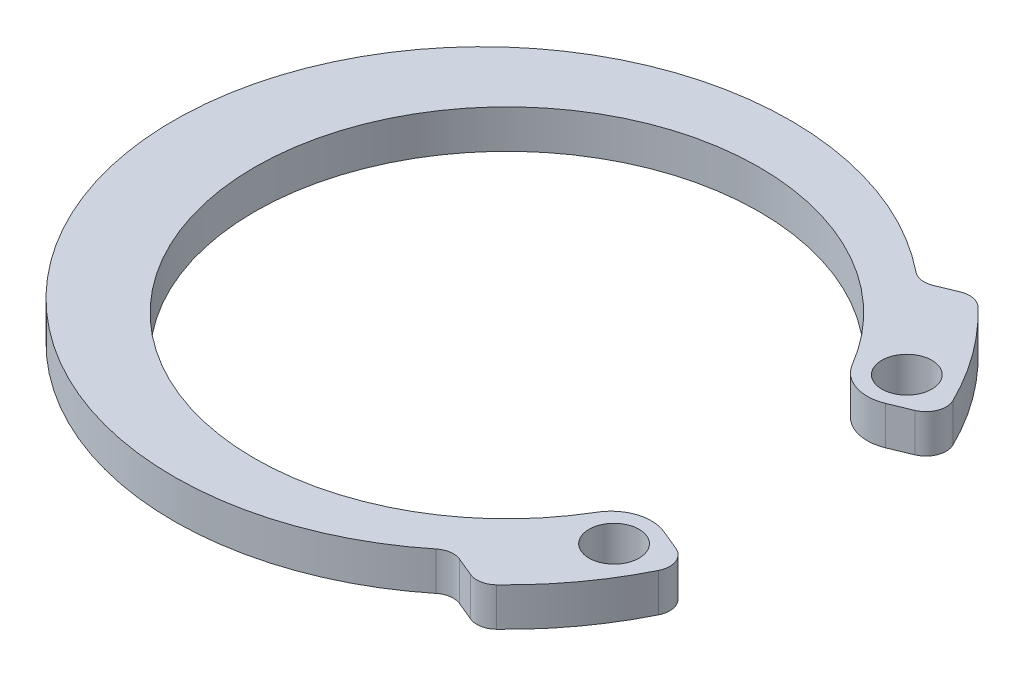
from build123d import *

# Parameters (mm, degrees)
BOSS_EXTRUDE1_DEPTH      = 0.5
BOSS_EXTRUDE1_DEPTH_BACK = 0.5
SKETCH3_R                = 0.65


with BuildPart() as part:
    # Sketch3 → Boss-Extrude1 (new, two sides: drawn at the far end of the back side and taken through both)
    with BuildSketch(Plane(origin=(0, 0, 0), x_dir=(1, 0, 0), z_dir=(0, 1, 0)).offset(-BOSS_EXTRUDE1_DEPTH_BACK)):
        with BuildLine():
            Line((4.921075662, 6.151466642), (5.415516704, 6.356270827))
            ThreePointArc((5.415516704, 6.356270827), (5.713132029, 6.387250398), (5.979333, 6.25060612))
            ThreePointArc((5.979333, 6.25060612), (6.97684177, 5.113333445), (7.760966936, 3.819671741))
            ThreePointArc((7.760966936, 3.819671741), (7.78120317, 3.402716753), (7.490834393, 3.102805199))
            Line((7.490834393, 3.102805199), (6.954149928, 2.880503215))
            ThreePointArc((6.954149928, 2.880503215), (6.218652108, 2.855007785), (5.647075885, 3.318589151))
            ThreePointArc((5.647075885, 3.318589151), (-6.55, 0), (5.647075885, -3.318589151))
            ThreePointArc((5.647075885, -3.318589151), (6.218652108, -2.855007785), (6.954149928, -2.880503215))
            Line((6.954149928, -2.880503215), (7.490834393, -3.102805199))
            ThreePointArc((7.490834393, -3.102805199), (7.78120317, -3.402716753), (7.760966936, -3.819671741))
            ThreePointArc((7.760966936, -3.819671741), (6.97684177, -5.113333445), (5.979333, -6.25060612))
            ThreePointArc((5.979333, -6.25060612), (5.713132029, -6.387250398), (5.415516704, -6.356270827))
            Line((5.415516704, -6.356270827), (4.921075662, -6.151466642))
            ThreePointArc((4.921075662, -6.151466642), (4.645102726, -6.116897415), (4.390197066, -6.228159258))
            ThreePointArc((4.390197066, -6.228159258), (-8.65, 0), (4.390197066, 6.228159258))
            ThreePointArc((4.390197066, 6.228159258), (4.645102726, 6.116897415), (4.921075662, 6.151466642))
        make_face()
        with Locations(Location((6.581793069, -3.8, 0), (0, 0, 270))):
            Circle(SKETCH3_R, mode=Mode.SUBTRACT)
        with Locations(Location((6.581793069, 3.8, 0), (0, 0, 270))):
            Circle(SKETCH3_R, mode=Mode.SUBTRACT)
    extrude(amount=BOSS_EXTRUDE1_DEPTH + BOSS_EXTRUDE1_DEPTH_BACK)


solid = part.part
